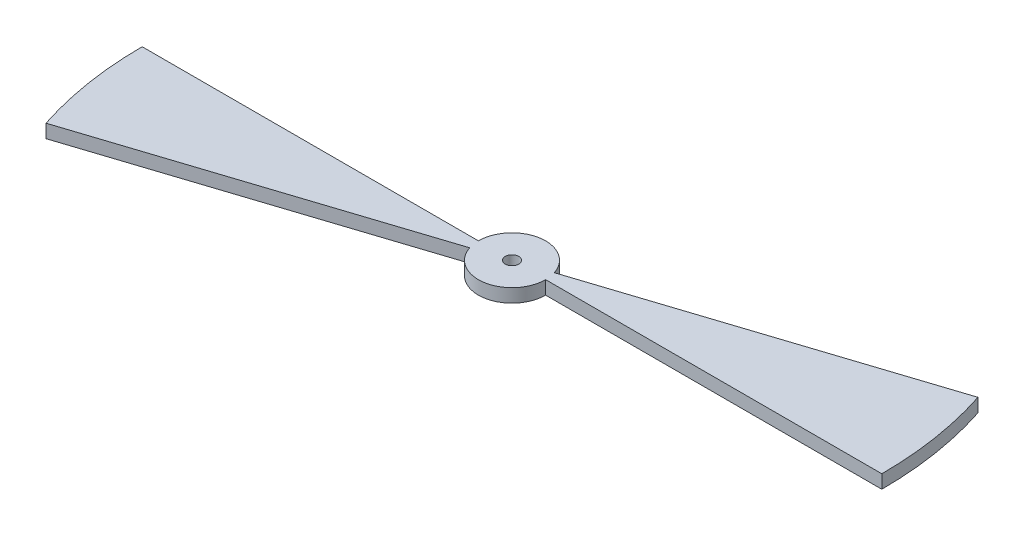
from build123d import *

# Parameters (mm, degrees)
SKETCH_1_R      = 2.5
SKETCH_1_R_2    = 0.5
EXTRUDE_1_DEPTH = 1


with BuildPart() as part:
    # 草图1 → 凸台-拉伸1 (new body)
    # profile 1 of 3: a face of its own
    with BuildSketch(Plane(origin=(0, 0, 0), x_dir=(1, 0, 0), z_dir=(0, 1, 0))):
        with BuildLine():
            Line((-26.154054198, -8.497967345), (-2.377641291, -0.772542486))
            ThreePointArc((-2.377641291, -0.772542486), (-2.469220851, -0.391086163), (-2.5, 0))
            Line((-2.5, 0), (-27.5, 0))
            ThreePointArc((-27.5, 0), (-27.161429366, -4.301947789), (-26.154054198, -8.497967345))
        make_face()
    # profile 2 of 3: a face of its own
    with BuildSketch(Plane(origin=(0, 0, 0), x_dir=(1, 0, 0), z_dir=(0, 1, 0))):
        with BuildLine():
            ThreePointArc((2.377641291, 0.772542486), (2.469220851, 0.391086163), (2.5, 0))
            Line((2.5, 0), (27.5, 0))
            ThreePointArc((27.5, 0), (27.161429366, 4.301947789), (26.154054198, 8.497967345))
            Line((26.154054198, 8.497967345), (2.377641291, 0.772542486))
        make_face()
    # profile 3 of 3: a face of its own
    with BuildSketch(Plane(origin=(0, 0, 0), x_dir=(1, 0, 0), z_dir=(0, 1, 0))):
        Circle(SKETCH_1_R)
        with Locations(Location((0, 0, 0), (0, 0, 270))):
            Circle(SKETCH_1_R_2, mode=Mode.SUBTRACT)
    extrude(amount=EXTRUDE_1_DEPTH)


solid = part.part
